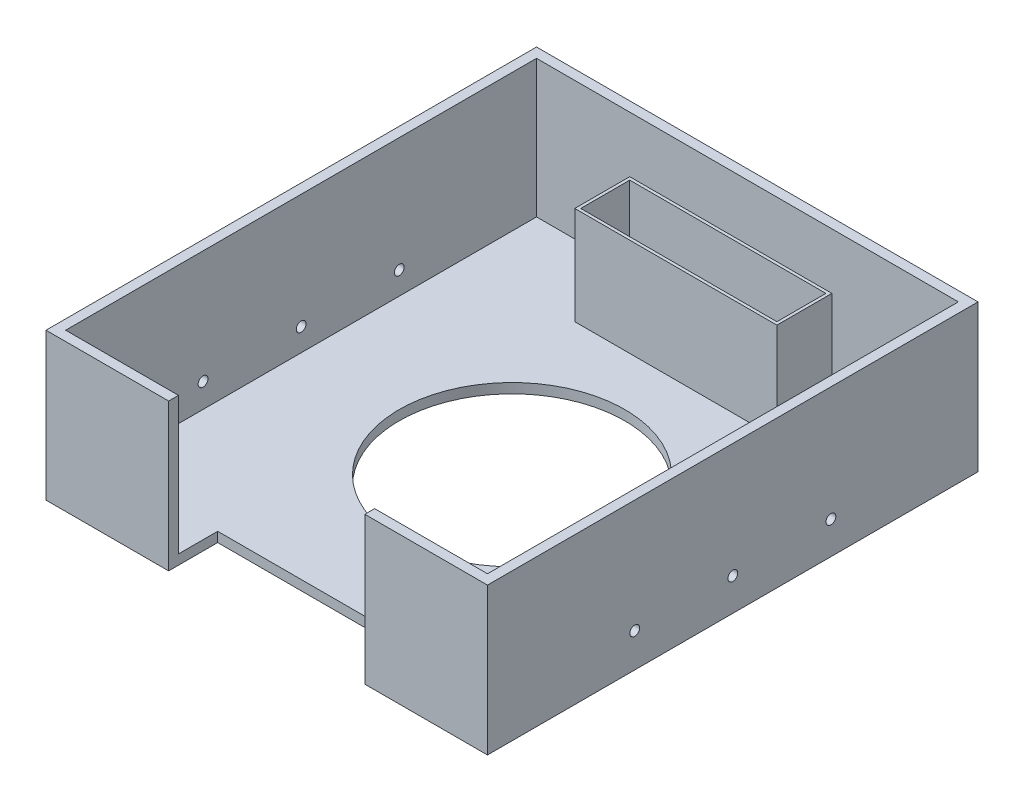
from build123d import *

# Parameters (mm, degrees)
SKETCH1_W           = 450
SKETCH1_H           = 500
BOSS_EXTRUDE1_DEPTH = 10
SKETCH2_W           = 450
SKETCH2_H           = 500
SKETCH2_W_2         = 430
SKETCH2_H_2         = 480
BOSS_EXTRUDE2_DEPTH = 140
SKETCH3_R           = 115
CUT_EXTRUDE1_DEPTH  = 10
SKETCH5_W           = 200
SKETCH5_H           = 100
CUT_EXTRUDE3_DEPTH  = 369.272996566
SKETCH6_R           = 5
CUT_EXTRUDE4_DEPTH  = 10
CUT_EXTRUDE5_START  = -10
SKETCH7_R           = 5
CUT_EXTRUDE5_DEPTH  = 10
SKETCH8_W           = 206
SKETCH8_H           = 56
SKETCH8_W_2         = 200
SKETCH8_H_2         = 50
BOSS_EXTRUDE3_DEPTH = 100


with BuildPart() as part:
    # Sketch1 → Boss-Extrude1 (new body)
    with BuildSketch(Plane(origin=(0, 0, 0), x_dir=(1, 0, 0), z_dir=(0, 1, 0))):
        Rectangle(SKETCH1_W, SKETCH1_H)
    extrude(amount=BOSS_EXTRUDE1_DEPTH)

    # Sketch2 → Boss-Extrude2 (add)
    with BuildSketch(Plane(origin=(0, 10, 0), x_dir=(1, 0, 0), z_dir=(0, 1, 0))):
        Rectangle(SKETCH2_W, SKETCH2_H)
        Rectangle(SKETCH2_W_2, SKETCH2_H_2, mode=Mode.SUBTRACT)
    extrude(amount=BOSS_EXTRUDE2_DEPTH)

    # Sketch3 → Cut-Extrude1 (cut)
    with BuildSketch(Plane(origin=(0, 10, 0), x_dir=(1, 0, 0), z_dir=(0, 1, 0))):
        with Locations(Location((0, 0, 0), (0, 0, 270))):
            Circle(SKETCH3_R)
    extrude(amount=-CUT_EXTRUDE1_DEPTH, mode=Mode.SUBTRACT)

    # Sketch5 → Cut-Extrude3 (cut, through all)
    with BuildSketch(Plane(origin=(0, 150, 0), x_dir=(1, 0, 0), z_dir=(0, 1, 0))):
        with Locations((0, -250)):
            Rectangle(SKETCH5_W, SKETCH5_H)
    extrude(amount=-CUT_EXTRUDE3_DEPTH, mode=Mode.SUBTRACT)

    # Sketch6 → Cut-Extrude4 (cut)
    with BuildSketch(Plane(origin=(225, 0, 0), x_dir=(0, 0, -1), z_dir=(1, 0, 0))):
        with Locations((-99.9, 34.7)):
            Circle(SKETCH6_R)
        with Locations((0.1, 33.13)):
            Circle(SKETCH6_R)
        with Locations((100.1, 33.13)):
            Circle(SKETCH6_R)
    extrude(amount=-CUT_EXTRUDE4_DEPTH, mode=Mode.SUBTRACT)

    # Sketch7 → Cut-Extrude5 (cut)
    with BuildSketch(Plane.ZY.offset(225).offset(CUT_EXTRUDE5_START)):
        with Locations(Location((-100.1, 33.13, 0), (0, 0, 180))):
            Circle(SKETCH7_R)
        with Locations(Location((-0.1, 33.13, 0), (0, 0, 180))):
            Circle(SKETCH7_R)
        with Locations(Location((99.9, 34.7, 0), (0, 0, 180))):
            Circle(SKETCH7_R)
    extrude(amount=CUT_EXTRUDE5_DEPTH, mode=Mode.SUBTRACT)

    # Sketch8 → Boss-Extrude3 (add)
    with BuildSketch(Plane(origin=(0, 10, 0), x_dir=(1, 0, 0), z_dir=(0, 1, 0))):
        with Locations((0, 195)):
            Rectangle(SKETCH8_W, SKETCH8_H)
        with Locations((0, 195)):
            Rectangle(SKETCH8_W_2, SKETCH8_H_2, mode=Mode.SUBTRACT)
    extrude(amount=BOSS_EXTRUDE3_DEPTH)


solid = part.part
